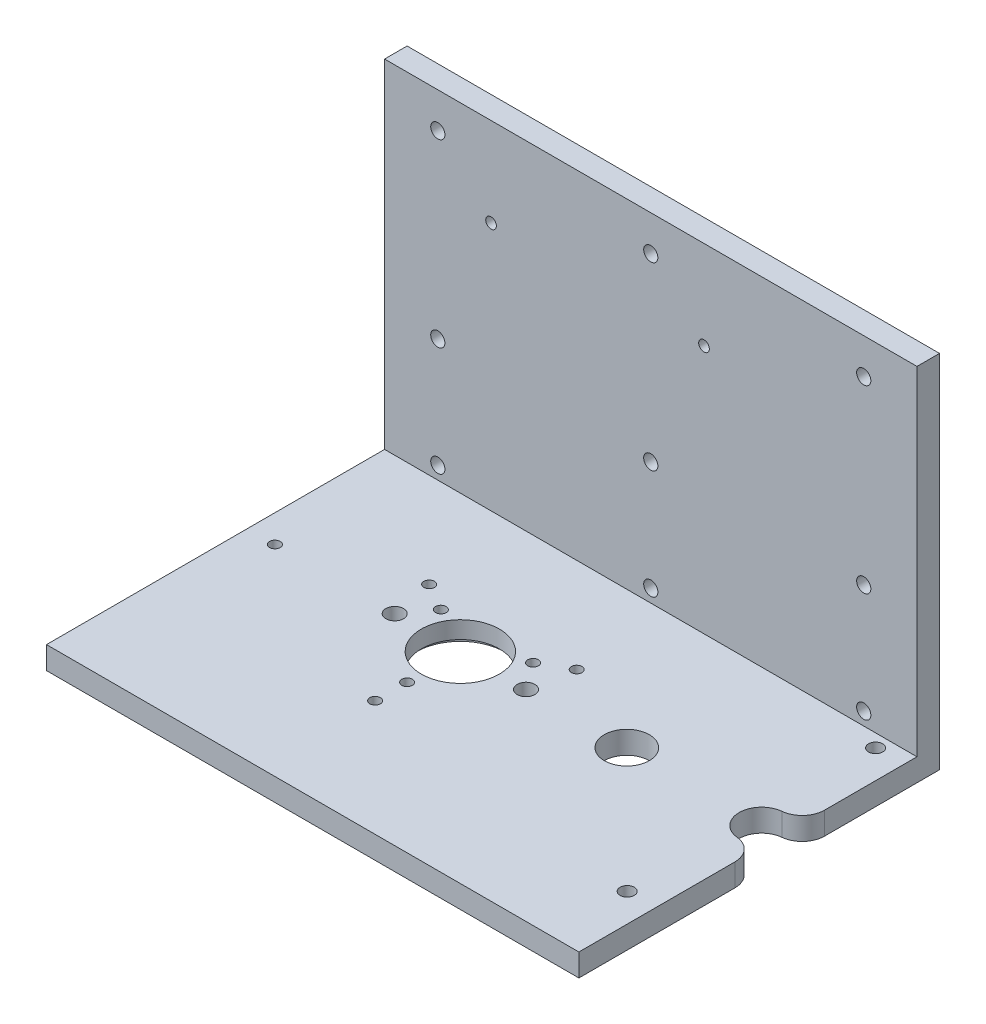
from build123d import *

# Parameters (mm, degrees)
CROQUIS1_W              = 150
CROQUIS1_H              = 101.6
SALIENTE_EXTRUIR1_DEPTH = 3.175
CROQUIS2_R              = 2
CROQUIS2_R_2            = 11
CROQUIS2_R_3            = 1.5
CROQUIS2_R_4            = 6.35
CORTAR_EXTRUIR1_DEPTH   = 91.807282197
REDONDEO1_R             = 6.35
CROQUIS3_R              = 1.5
CORTAR_EXTRUIR2_DEPTH   = 91.807282197
CORTAR_EXTRUIR3_START   = -3.175
CROQUIS4_R              = 12.5
CORTAR_EXTRUIR3_DEPTH   = 1.5
CROQUIS5_W              = 150
CROQUIS5_H              = 6.35
SALIENTE_EXTRUIR2_DEPTH = 101.6
CROQUIS6_R              = 2
CORTAR_EXTRUIR4_DEPTH   = 161.109464508
CROQUIS8_R              = 2.5
CORTAR_EXTRUIR5_DEPTH   = 137.118330874
CHAFL_N2_SIZE           = 2.5
CROQUIS9_R              = 1.5
CORTAR_EXTRUIR6_DEPTH   = 161.109464508


with BuildPart() as part:
    # Croquis1 → Saliente-Extruir1 (new, symmetric)
    with BuildSketch(Plane(origin=(0, 0, 0), x_dir=(1, 0, 0), z_dir=(0, 1, 0))):
        Rectangle(CROQUIS1_W, CROQUIS1_H)
    extrude(amount=SALIENTE_EXTRUIR1_DEPTH, both=True)

    # Croquis2 → Cortar-Extruir1 (cut, through all)
    with BuildSketch(Plane(origin=(0, 3.175, 0), x_dir=(1, 0, 0), z_dir=(0, 1, 0))):
        with Locations(Location((67, 40.8, 0), (0, 0, 270))):
            Circle(CROQUIS2_R)
        with Locations(Location((67, -29.2, 0), (0, 0, 90))):
            Circle(CROQUIS2_R)
        with Locations(Location((-15, 5.8, 0), (0, 0, 270))):
            Circle(CROQUIS2_R_2)
        with Locations(Location((-67.25, 5.8, 0), (0, 0, 270))):
            Circle(CROQUIS2_R_3)
        with Locations(Location((31.9, 5.8, 0), (0, 0, 270))):
            Circle(CROQUIS2_R_4)
        with Locations((69.9, 5.8)):
            Circle(CROQUIS2_R_4)
    extrude(amount=-CORTAR_EXTRUIR1_DEPTH, mode=Mode.SUBTRACT)

    # Redondeo1
    redondeo1_edges = [part.edges().sort_by_distance(p)[0] for p in [
        (75, 0, -2.016813512),
        (75, 0, -9.583186488),
    ]]
    fillet(redondeo1_edges, radius=REDONDEO1_R)

    # Croquis3 → Cortar-Extruir2 (cut, through all)
    with BuildSketch(Plane(origin=(0, 3.175, 0), x_dir=(1, 0, 0), z_dir=(0, 1, 0))):
        with Locations(Location((-15, -9.2, 0), (0, 0, 270))):
            Circle(CROQUIS3_R)
        with Locations(Location((-15, -18.2, 0), (0, 0, 270))):
            Circle(CROQUIS3_R)
        with Locations(Location((-27.990381057, 13.3, 0), (0, 0, 270))):
            Circle(CROQUIS3_R)
        with Locations(Location((-35.784609691, 17.8, 0), (0, 0, 270))):
            Circle(CROQUIS3_R)
        with Locations(Location((-2.009618943, 13.3, 0), (0, 0, 270))):
            Circle(CROQUIS3_R)
        with Locations(Location((5.784609691, 17.8, 0), (0, 0, 270))):
            Circle(CROQUIS3_R)
    extrude(amount=-CORTAR_EXTRUIR2_DEPTH, mode=Mode.SUBTRACT)

    # Croquis4 → Cortar-Extruir3 (cut)
    with BuildSketch(Plane(origin=(0, 0, 0), x_dir=(1, 0, 0), z_dir=(0, 1, 0)).offset(CORTAR_EXTRUIR3_START)):
        with Locations(Location((-15, 5.8, 0), (0, 0, 270))):
            Circle(CROQUIS4_R)
    extrude(amount=CORTAR_EXTRUIR3_DEPTH, mode=Mode.SUBTRACT)

    # Croquis5 → Saliente-Extruir2 (add)
    with BuildSketch(Plane.XZ.offset(3.175)):
        with Locations((0, -47.625)):
            Rectangle(CROQUIS5_W, CROQUIS5_H)
    extrude(amount=-SALIENTE_EXTRUIR2_DEPTH)

    # Croquis6 → Cortar-Extruir4 (cut, through all)
    with BuildSketch(Plane(origin=(0, 0, -50.8), x_dir=(-1, 0, 0), z_dir=(0, 0, -1))):
        with Locations((-60, 6.825)):
            Circle(CROQUIS6_R)
        with Locations((0, 6.825)):
            Circle(CROQUIS6_R)
        with Locations(Location((60, 6.825, 0), (0, 0, 180))):
            Circle(CROQUIS6_R)
        with Locations((60, 88.425)):
            Circle(CROQUIS6_R)
        with Locations(Location((0, 88.425, 0), (0, 0, 180))):
            Circle(CROQUIS6_R)
        with Locations(Location((-60, 88.425, 0), (0, 0, 180))):
            Circle(CROQUIS6_R)
        with Locations((-60, 37.625)):
            Circle(CROQUIS6_R)
        with Locations((0, 37.625)):
            Circle(CROQUIS6_R)
        with Locations(Location((60, 37.625, 0), (0, 0, 180))):
            Circle(CROQUIS6_R)
    extrude(amount=-CORTAR_EXTRUIR4_DEPTH, mode=Mode.SUBTRACT)

    # Croquis8 → Cortar-Extruir5 (cut, through all)
    with BuildSketch(Plane.XZ.offset(3.175)):
        with Locations(Location((3.5, -5.8, 0), (0, 0, 270))):
            Circle(CROQUIS8_R)
        with Locations(Location((-33.5, -5.8, 0), (0, 0, 90))):
            Circle(CROQUIS8_R)
    extrude(amount=-CORTAR_EXTRUIR5_DEPTH, mode=Mode.SUBTRACT)

    # Chaflán2
    chafl_n2_edges = [part.edges().sort_by_distance(p)[0] for p in [
        (3.5, -3.175, -3.3),
        (-33.5, -3.175, -8.3),
    ]]
    chamfer(chafl_n2_edges, length=CHAFL_N2_SIZE)

    # Croquis9 → Cortar-Extruir6 (cut, through all)
    with BuildSketch(Plane(origin=(0, 0, -50.8), x_dir=(-1, 0, 0), z_dir=(0, 0, -1))):
        with Locations((-15, 73.425)):
            Circle(CROQUIS9_R)
        with Locations(Location((45, 73.425, 0), (0, 0, 180))):
            Circle(CROQUIS9_R)
    extrude(amount=-CORTAR_EXTRUIR6_DEPTH, mode=Mode.SUBTRACT)


solid = part.part
